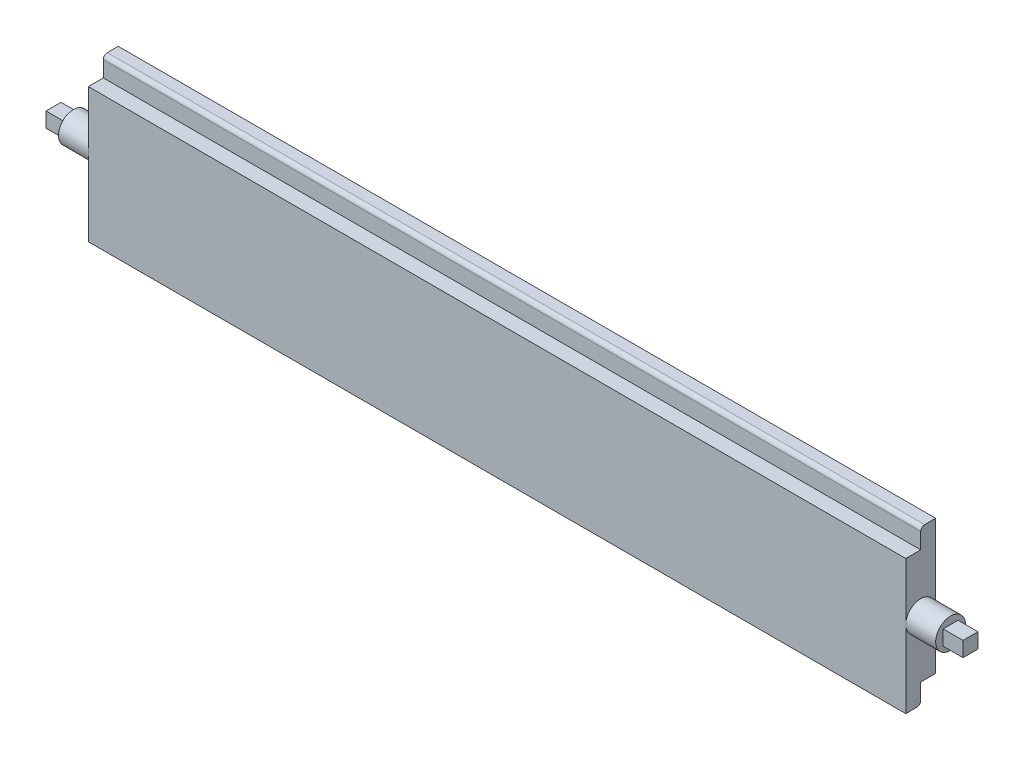
from build123d import *

# Parameters (mm, degrees)
SKETCH1_W           = 260.604
SKETCH1_H           = 49.1998
BOSS_EXTRUDE1_DEPTH = 4.7625
SKETCH2_R           = 4.7625
BOSS_EXTRUDE2_DEPTH = 9.525
SKETCH3_W           = 4.7752
SKETCH3_H           = 4.7752
BOSS_EXTRUDE3_DEPTH = 6.35
SKETCH4_W           = 260.604
SKETCH4_H           = 6.35
CUT_EXTRUDE1_DEPTH  = 4.7625
SKETCH5_W           = 260.604
SKETCH5_H           = 6.35
CUT_EXTRUDE2_DEPTH  = 4.7625
FILLET1_R           = 1.27


with BuildPart() as part:
    # Sketch1 → Boss-Extrude1 (new, symmetric)
    with BuildSketch(Plane.XY):
        Rectangle(SKETCH1_W, SKETCH1_H)
    extrude(amount=BOSS_EXTRUDE1_DEPTH, both=True)

    # Sketch2 → Boss-Extrude2 (add)
    with BuildSketch(Plane(origin=(130.302, 0, 0), x_dir=(0, 0, -1), z_dir=(1, 0, 0))):
        Circle(SKETCH2_R)
    boss_extrude2 = extrude(amount=BOSS_EXTRUDE2_DEPTH)

    # Sketch3 → Boss-Extrude3 (add)
    with BuildSketch(Plane(origin=(139.827, 0, 0), x_dir=(0, 0, -1), z_dir=(1, 0, 0))):
        Rectangle(SKETCH3_W, SKETCH3_H)
    boss_extrude3 = extrude(amount=BOSS_EXTRUDE3_DEPTH)

    # Mirror1: Boss-Extrude2, Boss-Extrude3 across plane
    add(boss_extrude2.mirror(Plane(origin=(0, 0, 0), x_dir=(0, 0, 1), z_dir=(1, 0, 0))))
    add(boss_extrude3.mirror(Plane(origin=(0, 0, 0), x_dir=(0, 0, 1), z_dir=(1, 0, 0))))

    # Sketch4 → Cut-Extrude1 (cut)
    with BuildSketch(Plane.XY.offset(4.7625)):
        with Locations((0, 21.4249)):
            Rectangle(SKETCH4_W, SKETCH4_H)
    extrude(amount=-CUT_EXTRUDE1_DEPTH, mode=Mode.SUBTRACT)

    # Sketch5 → Cut-Extrude2 (cut)
    with BuildSketch(Plane(origin=(0, 0, -4.7625), x_dir=(-1, 0, 0), z_dir=(0, 0, -1))):
        with Locations((0, -21.4249)):
            Rectangle(SKETCH5_W, SKETCH5_H)
    extrude(amount=-CUT_EXTRUDE2_DEPTH, mode=Mode.SUBTRACT)

    # Fillet1
    fillet1_edges = [part.edges().sort_by_distance(p)[0] for p in [
        (0, 24.5999, 0),
        (0, -24.5999, 0),
    ]]
    fillet(fillet1_edges, radius=FILLET1_R)


solid = part.part
